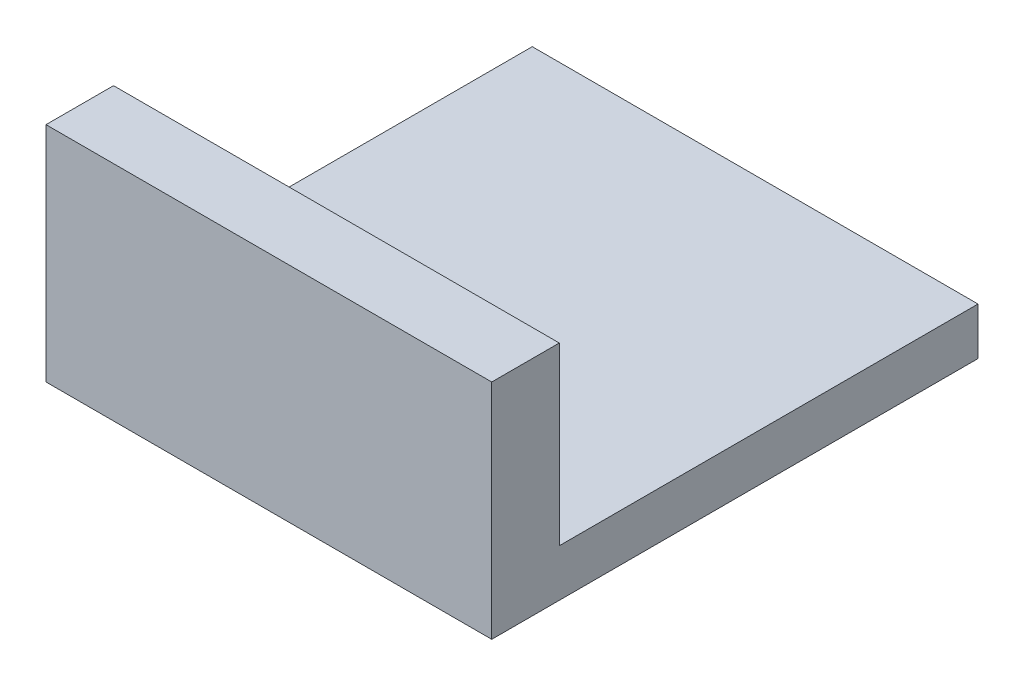
from build123d import *

# Parameters (mm, degrees)
SKETCH1_W           = 16.5
SKETCH1_H           = 18
BOSS_EXTRUDE1_DEPTH = 1.75
SKETCH3_W           = 16.5
SKETCH3_H           = 2.5
BOSS_EXTRUDE2_DEPTH = 6.5
SKETCH2_W           = 4
SKETCH2_H           = 4
BOSS_EXTRUDE3_DEPTH = 2


with BuildPart() as part:
    # Sketch1 → Boss-Extrude1 (new body)
    with BuildSketch(Plane(origin=(0, 0, 0), x_dir=(1, 0, 0), z_dir=(0, 1, 0))):
        Rectangle(SKETCH1_W, SKETCH1_H)
    extrude(amount=BOSS_EXTRUDE1_DEPTH)

    # Sketch3 → Boss-Extrude2 (add)
    with BuildSketch(Plane(origin=(0, 1.75, 0), x_dir=(1, 0, 0), z_dir=(0, 1, 0))):
        with Locations((0, -7.75)):
            Rectangle(SKETCH3_W, SKETCH3_H)
    extrude(amount=BOSS_EXTRUDE2_DEPTH)

    # Sketch2 → Boss-Extrude3 (add)
    with BuildSketch(Plane(origin=(0, 0, 0), x_dir=(1, 0, 0), z_dir=(0, 1, 0))):
        with Locations((0, -1)):
            Rectangle(SKETCH2_W, SKETCH2_H)
    extrude(amount=-BOSS_EXTRUDE3_DEPTH)


solid = part.part
